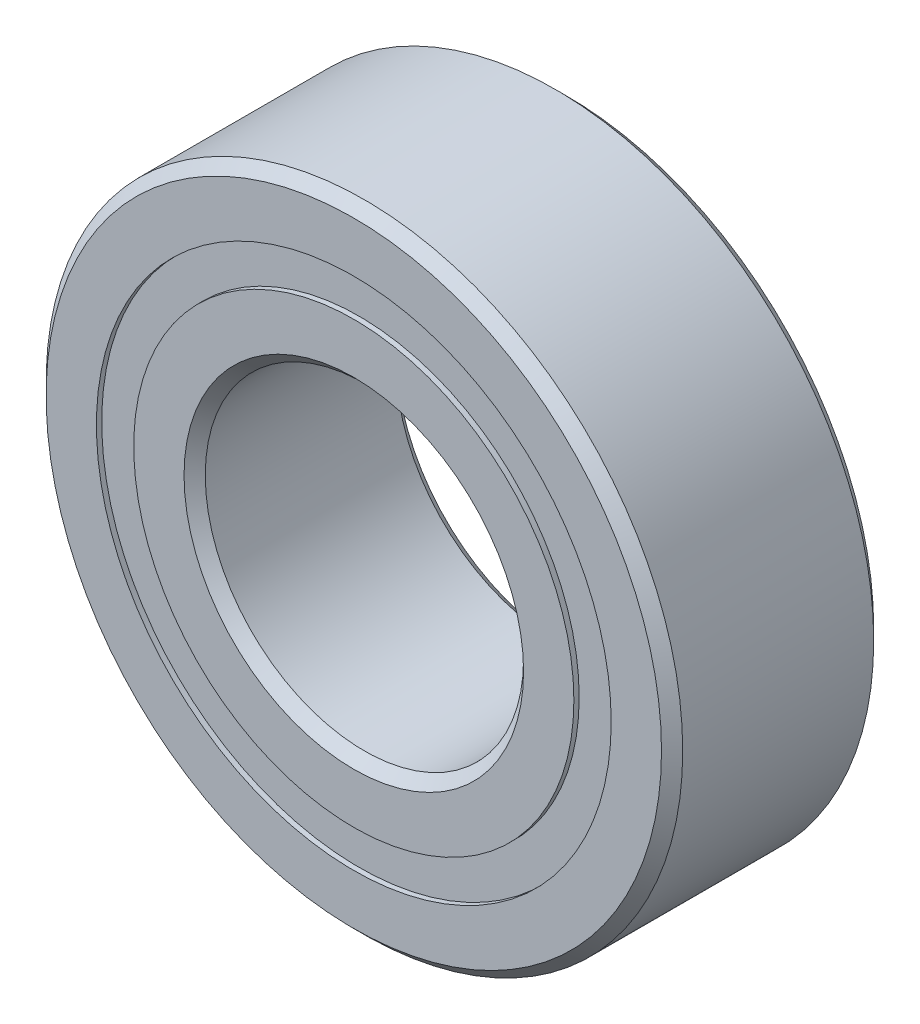
from build123d import *

# Parameters (mm, degrees)
CIRPATTERN1_COUNT = 12
SKETCH5_W         = 0.944081583
SKETCH5_H         = 0.703296704


with BuildPart() as part:
    # Sketch1 → Revolve1 (revolve)
    with BuildSketch(Plane(origin=(0, 0, 0), x_dir=(0, 0, -1), z_dir=(1, 0, 0))):
        with BuildLine():
            Line((1.8, 6), (-1.8, 6))
            Line((-1.8, 6), (-2, 5.8))
            Line((-2, 5.8), (-2, 4.851648352))
            Line((-2, 4.851648352), (-0.888888889, 4.851648352))
            ThreePointArc((-0.888888889, 4.851648352), (0, 5.455918417), (0.888888889, 4.851648352))
            Line((0.888888889, 4.851648352), (2, 4.851648352))
            Line((2, 4.851648352), (2, 5.8))
            Line((2, 5.8), (1.8, 6))
        make_face()
    revolve(axis=Axis((0, 0, 2), (0, 0, -1)))


with BuildPart() as body_2:
    # Sketch3 → Revolve3 (revolve)
    with BuildSketch(Plane(origin=(0, 0, 0), x_dir=(0, 0, -1), z_dir=(1, 0, 0))):
        with BuildLine():
            Line((-2, 4.148351648), (-0.888888889, 4.148351648))
            ThreePointArc((-0.888888889, 4.148351648), (0, 3.544081583), (0.888888889, 4.148351648))
            Line((0.888888889, 4.148351648), (2, 4.148351648))
            Line((2, 4.148351648), (2, 3.2))
            Line((2, 3.2), (1.8, 3))
            Line((1.8, 3), (-1.8, 3))
            Line((-1.8, 3), (-2, 3.2))
            Line((-2, 3.2), (-2, 4.148351648))
        make_face()
    revolve(axis=Axis((0, 0, 2), (0, 0, -1)))


with BuildPart() as body_3:
    # Sketch4 → Revolve4 (revolve)
    with BuildSketch(Plane(origin=(0, 0, 0), x_dir=(0, 0, -1), z_dir=(1, 0, 0))):
        with BuildLine():
            Line((-0.955918417, 4.5), (0.955918417, 4.5))
            ThreePointArc((0.955918417, 4.5), (0, 5.455918417), (-0.955918417, 4.5))
        make_face()
    revolve(axis=Axis((0, 4.5, 0.955918417), (0, 0, -1)))


with BuildPart() as cirpattern1_1:
    # CirPattern1: pattern copy
    add(body_3.part.rotate(Axis((0, 0, -2), (0, 0, 1)), 1 * 360 / CIRPATTERN1_COUNT))


with BuildPart() as cirpattern1_2:
    # CirPattern1: pattern copy
    add(body_3.part.rotate(Axis((0, 0, -2), (0, 0, 1)), 2 * 360 / CIRPATTERN1_COUNT))


with BuildPart() as cirpattern1_3:
    # CirPattern1: pattern copy
    add(body_3.part.rotate(Axis((0, 0, -2), (0, 0, 1)), 3 * 360 / CIRPATTERN1_COUNT))


with BuildPart() as cirpattern1_4:
    # CirPattern1: pattern copy
    add(body_3.part.rotate(Axis((0, 0, -2), (0, 0, 1)), 4 * 360 / CIRPATTERN1_COUNT))


with BuildPart() as cirpattern1_5:
    # CirPattern1: pattern copy
    add(body_3.part.rotate(Axis((0, 0, -2), (0, 0, 1)), 5 * 360 / CIRPATTERN1_COUNT))


with BuildPart() as cirpattern1_6:
    # CirPattern1: pattern copy
    add(body_3.part.rotate(Axis((0, 0, -2), (0, 0, 1)), 6 * 360 / CIRPATTERN1_COUNT))


with BuildPart() as cirpattern1_7:
    # CirPattern1: pattern copy
    add(body_3.part.rotate(Axis((0, 0, -2), (0, 0, 1)), 7 * 360 / CIRPATTERN1_COUNT))


with BuildPart() as cirpattern1_8:
    # CirPattern1: pattern copy
    add(body_3.part.rotate(Axis((0, 0, -2), (0, 0, 1)), 8 * 360 / CIRPATTERN1_COUNT))


with BuildPart() as cirpattern1_9:
    # CirPattern1: pattern copy
    add(body_3.part.rotate(Axis((0, 0, -2), (0, 0, 1)), 9 * 360 / CIRPATTERN1_COUNT))


with BuildPart() as cirpattern1_10:
    # CirPattern1: pattern copy
    add(body_3.part.rotate(Axis((0, 0, -2), (0, 0, 1)), 10 * 360 / CIRPATTERN1_COUNT))


with BuildPart() as cirpattern1_11:
    # CirPattern1: pattern copy
    add(body_3.part.rotate(Axis((0, 0, -2), (0, 0, 1)), 11 * 360 / CIRPATTERN1_COUNT))


with BuildPart() as body_15:
    # Sketch5 → Revolve5 (revolve)
    with BuildSketch(Plane(origin=(0, 0, 0), x_dir=(0, 0, -1), z_dir=(1, 0, 0))):
        with Locations((-1.427959209, 4.5)):
            Rectangle(SKETCH5_W, SKETCH5_H)
        with Locations((1.427959209, 4.5)):
            Rectangle(SKETCH5_W, SKETCH5_H)
    revolve(axis=Axis((0, 0, 2), (0, 0, -1)))


solid = Compound([part.part, body_2.part, body_3.part, cirpattern1_1.part, cirpattern1_2.part, cirpattern1_3.part, cirpattern1_4.part, cirpattern1_5.part, cirpattern1_6.part, cirpattern1_7.part, cirpattern1_8.part, cirpattern1_9.part, cirpattern1_10.part, cirpattern1_11.part, body_15.part])
